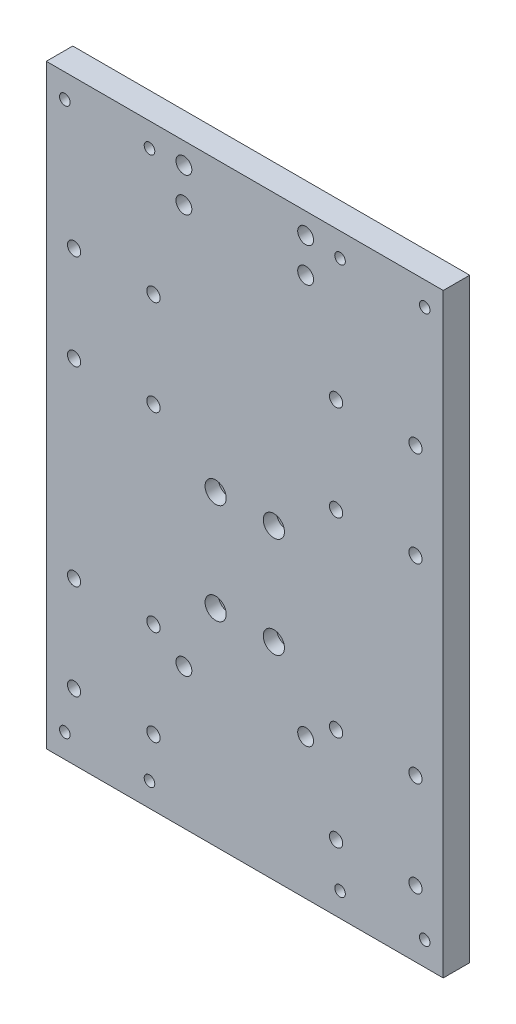
from build123d import *

# Parameters (mm, degrees)
CROQUIS1_W              = 150
CROQUIS1_H              = 225
SALIENTE_EXTRUIR1_DEPTH = 10
CROQUIS2_R              = 2.5
CORTAR_EXTRUIR1_DEPTH   = 271.601182555
CROQUIS3_R              = 3
CORTAR_EXTRUIR3_DEPTH   = 271.601182555
CROQUIS6_R              = 4
CORTAR_EXTRUIR5_DEPTH   = 5
CROQUIS7_R              = 2
CORTAR_EXTRUIR6_DEPTH   = 271.601182555
CROQUIS8_R              = 3
CORTAR_EXTRUIR7_DEPTH   = 271.601182555


with BuildPart() as part:
    # Croquis1 → Saliente-Extruir1 (new body)
    with BuildSketch(Plane.XY):
        with Locations((75, 112.5)):
            Rectangle(CROQUIS1_W, CROQUIS1_H)
    extrude(amount=SALIENTE_EXTRUIR1_DEPTH)

    # Croquis2 → Cortar-Extruir1 (cut, through all)
    with BuildSketch(Plane.XY.offset(10)):
        with Locations((10.5, 169)):
            Circle(CROQUIS2_R)
        with Locations((40.5, 169)):
            Circle(CROQUIS2_R)
        with Locations((10.5, 133)):
            Circle(CROQUIS2_R)
        with Locations((40.5, 133)):
            Circle(CROQUIS2_R)
        with Locations(Location((109.5, 133, 0), (0, 0, 180))):
            Circle(CROQUIS2_R)
        with Locations(Location((109.5, 169, 0), (0, 0, 180))):
            Circle(CROQUIS2_R)
        with Locations(Location((139.5, 133, 0), (0, 0, 180))):
            Circle(CROQUIS2_R)
        with Locations(Location((139.5, 169, 0), (0, 0, 180))):
            Circle(CROQUIS2_R)
        with Locations((139.5, 61)):
            Circle(CROQUIS2_R)
        with Locations((109.5, 61)):
            Circle(CROQUIS2_R)
        with Locations((139.5, 25)):
            Circle(CROQUIS2_R)
        with Locations((109.5, 25)):
            Circle(CROQUIS2_R)
        with Locations(Location((40.5, 61, 0), (0, 0, 180))):
            Circle(CROQUIS2_R)
        with Locations(Location((40.5, 25, 0), (0, 0, 180))):
            Circle(CROQUIS2_R)
        with Locations(Location((10.5, 61, 0), (0, 0, 180))):
            Circle(CROQUIS2_R)
        with Locations(Location((10.5, 25, 0), (0, 0, 180))):
            Circle(CROQUIS2_R)
    extrude(amount=-CORTAR_EXTRUIR1_DEPTH, mode=Mode.SUBTRACT)

    # Croquis3 → Cortar-Extruir3 (cut, through all)
    with BuildSketch(Plane.XY.offset(10)):
        with Locations((64, 116)):
            Circle(CROQUIS3_R)
        with Locations((64, 78)):
            Circle(CROQUIS3_R)
        with Locations((86, 78)):
            Circle(CROQUIS3_R)
        with Locations((86, 116)):
            Circle(CROQUIS3_R)
    extrude(amount=-CORTAR_EXTRUIR3_DEPTH, mode=Mode.SUBTRACT)

    # Croquis6 → Cortar-Extruir5 (cut)
    with BuildSketch(Plane.XY.offset(10)):
        with Locations((64, 116)):
            Circle(CROQUIS6_R)
        with Locations((64, 78)):
            Circle(CROQUIS6_R)
        with Locations((86, 78)):
            Circle(CROQUIS6_R)
        with Locations((86, 116)):
            Circle(CROQUIS6_R)
    extrude(amount=-CORTAR_EXTRUIR5_DEPTH, mode=Mode.SUBTRACT)

    # Croquis7 → Cortar-Extruir6 (cut, through all)
    with BuildSketch(Plane(origin=(0, 0, 0), x_dir=(-1, 0, 0), z_dir=(0, 0, -1))):
        with Locations((-143, 216)):
            Circle(CROQUIS7_R)
        with Locations((-111, 216)):
            Circle(CROQUIS7_R)
        with Locations(Location((-39, 216, 0), (0, 0, 180))):
            Circle(CROQUIS7_R)
        with Locations(Location((-7, 216, 0), (0, 0, 180))):
            Circle(CROQUIS7_R)
        with Locations((-7, 9)):
            Circle(CROQUIS7_R)
        with Locations((-39, 9)):
            Circle(CROQUIS7_R)
        with Locations(Location((-111, 9, 0), (0, 0, 180))):
            Circle(CROQUIS7_R)
        with Locations(Location((-143, 9, 0), (0, 0, 180))):
            Circle(CROQUIS7_R)
    extrude(amount=-CORTAR_EXTRUIR6_DEPTH, mode=Mode.SUBTRACT)

    # Croquis8 → Cortar-Extruir7 (cut, through all)
    with BuildSketch(Plane(origin=(0, 0, 0), x_dir=(-1, 0, 0), z_dir=(0, 0, -1))):
        with Locations((-98, 217)):
            Circle(CROQUIS8_R)
        with Locations((-52, 217)):
            Circle(CROQUIS8_R)
        with Locations((-98, 204)):
            Circle(CROQUIS8_R)
        with Locations((-52, 204)):
            Circle(CROQUIS8_R)
        with Locations((-98, 53)):
            Circle(CROQUIS8_R)
        with Locations((-52, 53)):
            Circle(CROQUIS8_R)
    extrude(amount=-CORTAR_EXTRUIR7_DEPTH, mode=Mode.SUBTRACT)


solid = part.part
